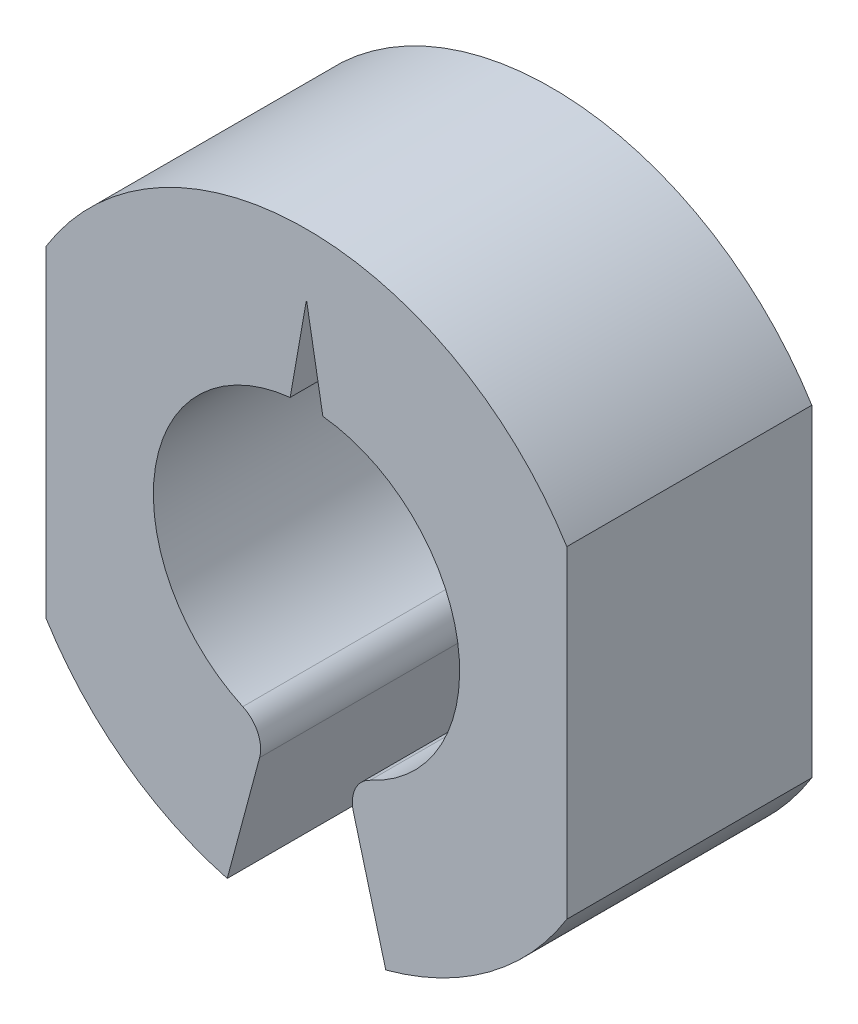
from build123d import *

# Parameters (mm, degrees)
EXTRUDE_1_DEPTH     = 8
FILLET_1_R          = 1
CUT_EXTRUDE_START   = -10
CUT_EXTRUDE_1_DEPTH = 10
CUT_EXTRUDE_2_DEPTH = 16.370426149


with BuildPart() as part:
    # 草图1 → 凸台-拉伸1 (new body)
    with BuildSketch(Plane.XY):
        with BuildLine():
            Line((1.294095226, -4.829629131), (2.588190451, -9.659258263))
            ThreePointArc((2.588190451, -9.659258263), (0, 10), (-2.588190451, -9.659258263))
            Line((-2.588190451, -9.659258263), (-1.294095226, -4.829629131))
            ThreePointArc((-1.294095226, -4.829629131), (0, 5), (1.294095226, -4.829629131))
        make_face()
    extrude(amount=EXTRUDE_1_DEPTH)

    # 圆角1
    fillet_1_edges = [part.edges().sort_by_distance(p)[0] for p in [
        (-1.294095226, -4.829629131, 4),
        (1.294095226, -4.829629131, 4),
    ]]
    fillet(fillet_1_edges, radius=FILLET_1_R)

    # 草图2 → 切除-拉伸1 (cut)
    with BuildSketch(Plane.XY.offset(8).offset(CUT_EXTRUDE_START)):
        with BuildLine():
            Line((-8.5, 5.267826876), (-8.5, -5.267826876))
            ThreePointArc((-8.5, -5.267826876), (-10, 0), (-8.5, 5.267826876))
        make_face()
        with BuildLine():
            Line((8.5, 5.267826876), (8.5, -5.267826876))
            ThreePointArc((8.5, -5.267826876), (10, 0), (8.5, 5.267826876))
        make_face()
    extrude(amount=CUT_EXTRUDE_1_DEPTH, mode=Mode.SUBTRACT)

    # 草图3 → 切除-拉伸2 (cut, through all)
    with BuildSketch(Plane(origin=(0, 0, 0), x_dir=(-1, 0, 0), z_dir=(0, 0, -1))):
        with BuildLine():
            Line((0, 8), (-0.534023884, 4.971400053))
            ThreePointArc((-0.534023884, 4.971400053), (0, 5), (0.534023884, 4.971400053))
            Line((0.534023884, 4.971400053), (0, 8))
        make_face()
    extrude(amount=-CUT_EXTRUDE_2_DEPTH, mode=Mode.SUBTRACT)


solid = part.part
